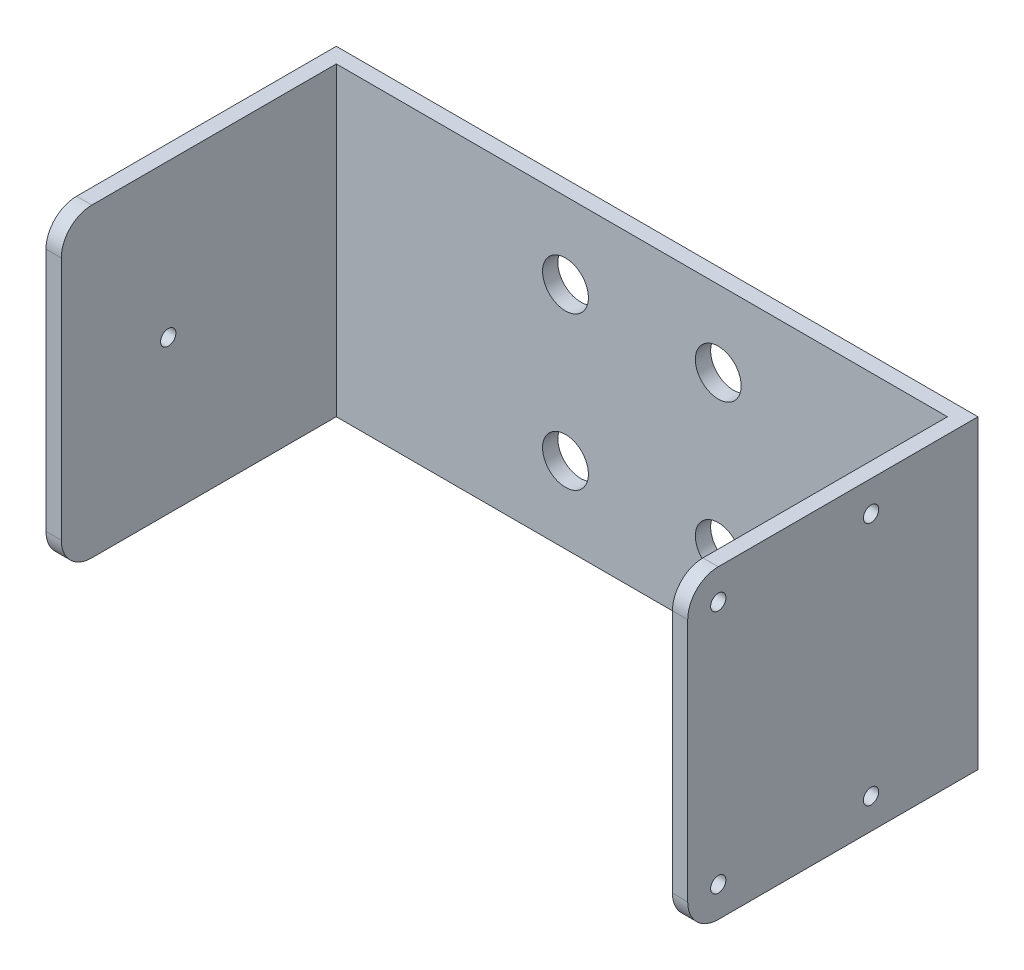
from build123d import *

# Parameters (mm, degrees)
SKETCH_1_W          = 42
SKETCH_1_H          = 20
EXTRUDE_1_DEPTH     = 1
SKETCH_2_W          = 1
SKETCH_2_H          = 20
EXTRUDE_2_DEPTH     = 18
CUT_EXTRUDE_1_REACH = 49.17
SKETCH_3_R          = 0.5
FILLET_1_R          = 2
FILLET_2_R          = 2
FILLET_4_R          = 2
CUT_EXTRUDE_2_REACH = 49.17
SKETCH_6_R          = 0.5
SKETCH_7_R          = 1.5
CUT_EXTRUDE_3_DEPTH = 10


with BuildPart() as part:
    # 草图1 → 凸台-拉伸1 (new body)
    with BuildSketch(Plane.XY):
        Rectangle(SKETCH_1_W, SKETCH_1_H)
    extrude(amount=EXTRUDE_1_DEPTH)

    # 草图2 → 凸台-拉伸2 (add)
    with BuildSketch(Plane.XY.offset(1)):
        with Locations((-20.5, 0)):
            Rectangle(SKETCH_2_W, SKETCH_2_H)
        with Locations((20.5, 0)):
            Rectangle(SKETCH_2_W, SKETCH_2_H)
    extrude(amount=EXTRUDE_2_DEPTH)

    # 草图3 → 切除-拉伸1 (cut, up to next)
    with BuildSketch(Plane(origin=(21, 0, 0), x_dir=(0, 0, -1), z_dir=(1, 0, 0)), mode=Mode.PRIVATE) as cut_extrude_1_sk1:
        with Locations(Location((-17, 8, 0), (0, 0, 90))):
            Circle(SKETCH_3_R)
    cut_extrude_1_tool1 = extrude(cut_extrude_1_sk1.sketch, amount=-CUT_EXTRUDE_1_REACH, mode=Mode.PRIVATE) & part.part
    # 草图3 → 切除-拉伸1 (cut, up to next)
    with BuildSketch(Plane(origin=(21, 0, 0), x_dir=(0, 0, -1), z_dir=(1, 0, 0)), mode=Mode.PRIVATE) as cut_extrude_1_sk2:
        with Locations(Location((-7, 8, 0), (0, 0, 90))):
            Circle(SKETCH_3_R)
    cut_extrude_1_tool2 = extrude(cut_extrude_1_sk2.sketch, amount=-CUT_EXTRUDE_1_REACH, mode=Mode.PRIVATE) & part.part
    # 草图3 → 切除-拉伸1 (cut, up to next)
    with BuildSketch(Plane(origin=(21, 0, 0), x_dir=(0, 0, -1), z_dir=(1, 0, 0)), mode=Mode.PRIVATE) as cut_extrude_1_sk3:
        with Locations(Location((-7, -8, 0), (0, 0, 90))):
            Circle(SKETCH_3_R)
    cut_extrude_1_tool3 = extrude(cut_extrude_1_sk3.sketch, amount=-CUT_EXTRUDE_1_REACH, mode=Mode.PRIVATE) & part.part
    # 草图3 → 切除-拉伸1 (cut, up to next)
    with BuildSketch(Plane(origin=(21, 0, 0), x_dir=(0, 0, -1), z_dir=(1, 0, 0)), mode=Mode.PRIVATE) as cut_extrude_1_sk4:
        with Locations(Location((-17, -8, 0), (0, 0, 90))):
            Circle(SKETCH_3_R)
    cut_extrude_1_tool4 = extrude(cut_extrude_1_sk4.sketch, amount=-CUT_EXTRUDE_1_REACH, mode=Mode.PRIVATE) & part.part
    add(cut_extrude_1_tool1.solids().sort_by_distance((21, 8, 17))[0], mode=Mode.SUBTRACT)
    add(cut_extrude_1_tool2.solids().sort_by_distance((21, 8, 7))[0], mode=Mode.SUBTRACT)
    add(cut_extrude_1_tool3.solids().sort_by_distance((21, -8, 7))[0], mode=Mode.SUBTRACT)
    add(cut_extrude_1_tool4.solids().sort_by_distance((21, -8, 17))[0], mode=Mode.SUBTRACT)

    # 圆角1
    fillet_1_edges = [part.edges().sort_by_distance(p)[0] for p in [
        (20.5, 10, 19),
        (20.5, -10, 19),
    ]]
    fillet(fillet_1_edges, radius=FILLET_1_R)

    # 圆角2
    fillet_2_edges = [part.edges().sort_by_distance(p)[0] for p in [
        (-20.5, 10, 19),
    ]]
    fillet(fillet_2_edges, radius=FILLET_2_R)

    # 圆角4
    fillet_4_edges = [part.edges().sort_by_distance(p)[0] for p in [
        (-20.5, -10, 19),
    ]]
    fillet(fillet_4_edges, radius=FILLET_4_R)

    # 草图6 → 切除-拉伸2 (cut, up to next)
    with BuildSketch(Plane.ZY.offset(21), mode=Mode.PRIVATE) as cut_extrude_2_sk1:
        with Locations((12, 0)):
            Circle(SKETCH_6_R)
    cut_extrude_2_tool1 = extrude(cut_extrude_2_sk1.sketch, amount=-CUT_EXTRUDE_2_REACH, mode=Mode.PRIVATE) & part.part
    add(cut_extrude_2_tool1.solids().sort_by_distance((-21, 0, 12))[0], mode=Mode.SUBTRACT)

    # 草图7 → 切除-拉伸3 (cut)
    with BuildSketch(Plane(origin=(0, 0, 0), x_dir=(-1, 0, 0), z_dir=(0, 0, -1))):
        with Locations((5, -5)):
            Circle(SKETCH_7_R)
        with Locations((-5, -5)):
            Circle(SKETCH_7_R)
        with Locations((-5, 5)):
            Circle(SKETCH_7_R)
        with Locations((5, 5)):
            Circle(SKETCH_7_R)
    extrude(amount=-CUT_EXTRUDE_3_DEPTH, mode=Mode.SUBTRACT)


solid = part.part
